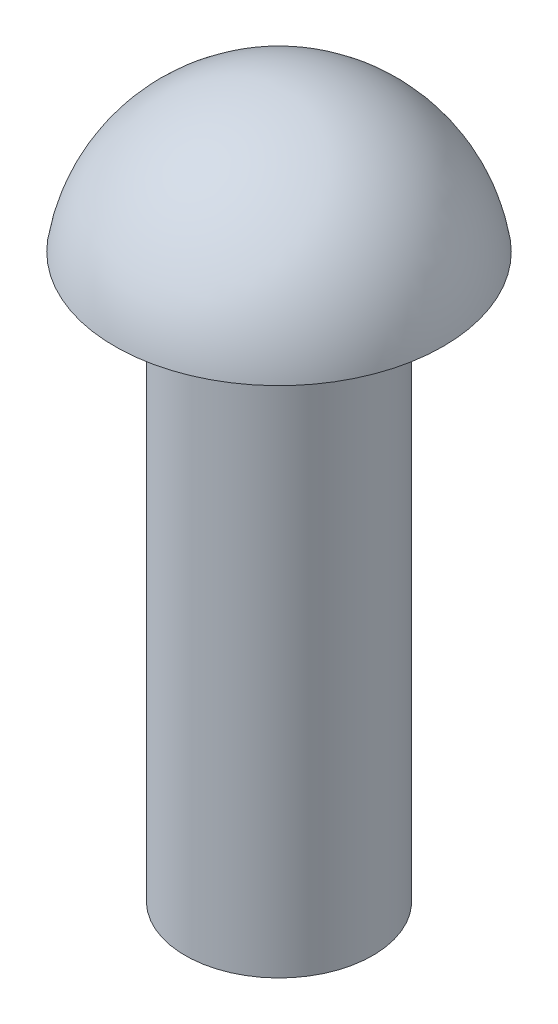
from build123d import *


with BuildPart() as part:
    # Sketch1 → Revolve1 (revolve)
    with BuildSketch(Plane.XY, mode=Mode.PRIVATE) as revolve1_sk:
        with BuildLine():
            Line((0, 0), (6.35, 0))
            Line((6.35, 0), (6.35, 38.1))
            Line((6.35, 38.1), (11.118848187, 38.1))
            ThreePointArc((11.118848187, 38.1), (7.320423656, 44.918173154), (0, 47.625))
            Line((0, 47.625), (0, 0))
        make_face()
    revolve(revolve1_sk.sketch.rotate(Axis((0, 0, 0), (0, 1, 0)), 90), axis=Axis((0, 0, 0), (0, 1, 0)))


solid = part.part
